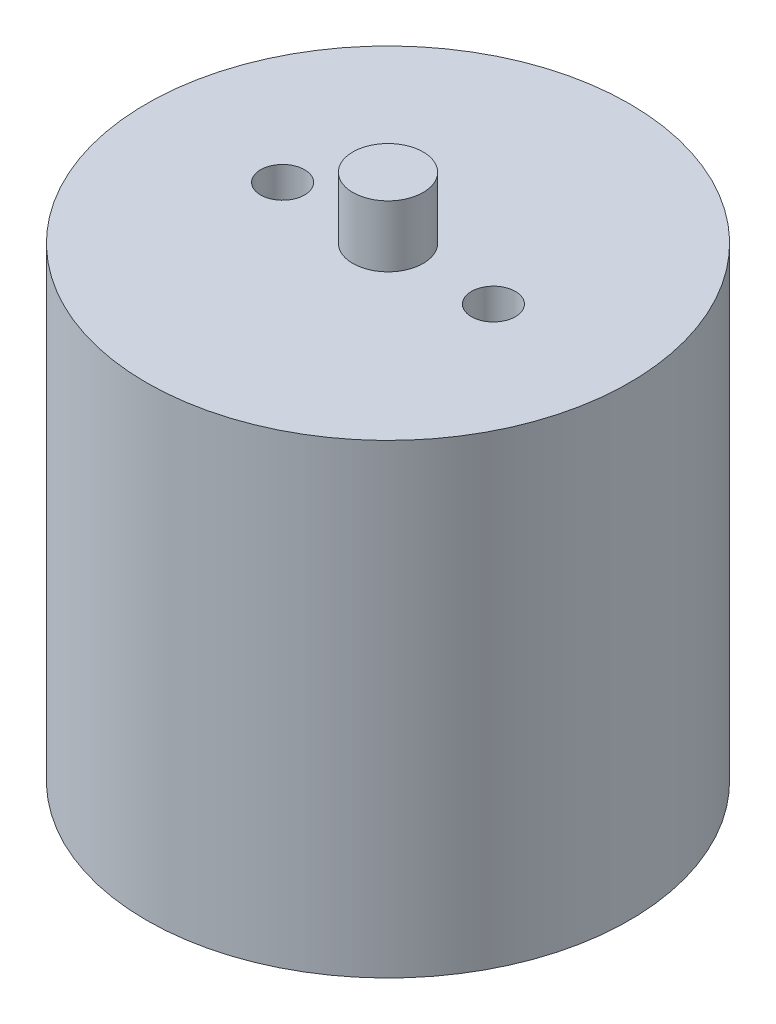
from build123d import *

# Parameters (mm, degrees)
SKETCH2_R           = 13.75
BOSS_EXTRUDE1_DEPTH = 26.5
SKETCH3_R           = 2
BOSS_EXTRUDE2_DEPTH = 3.5
SKETCH4_R           = 1.25
CUT_EXTRUDE1_DEPTH  = 5
BOSS_EXTRUDE3_REACH = 39.959
SKETCH1_R           = 2
SKETCH5_R           = 1.25
CUT_EXTRUDE2_DEPTH  = 5


with BuildPart() as part:
    # Sketch2 → Boss-Extrude1 (new body)
    with BuildSketch(Plane(origin=(0, 2.6, 0), x_dir=(1, 0, 0), z_dir=(0, 1, 0))):
        with Locations(Location((0, 0, 0), (0, 0, 270))):
            Circle(SKETCH2_R)
    extrude(amount=BOSS_EXTRUDE1_DEPTH)

    # Sketch3 → Boss-Extrude2 (add)
    with BuildSketch(Plane(origin=(0, 29.1, 0), x_dir=(1, 0, 0), z_dir=(0, 1, 0))):
        with Locations(Location((0, 0, 0), (0, 0, 270))):
            Circle(SKETCH3_R)
    extrude(amount=BOSS_EXTRUDE2_DEPTH)

    # Sketch4 → Cut-Extrude1 (cut)
    with BuildSketch(Plane(origin=(0, 29.1, 0), x_dir=(1, 0, 0), z_dir=(0, 1, 0))):
        with Locations(Location((-6, 0, 0), (0, 0, 270))):
            Circle(SKETCH4_R)
        with Locations(Location((6, 0, 0), (0, 0, 270))):
            Circle(SKETCH4_R)
    extrude(amount=-CUT_EXTRUDE1_DEPTH, mode=Mode.SUBTRACT)

    # Sketch1 → Boss-Extrude3 (add, up to next)
    with BuildSketch(Plane(origin=(0, 0, 0), x_dir=(1, 0, 0), z_dir=(0, 1, 0)), mode=Mode.PRIVATE) as boss_extrude3_sk1:
        with Locations(Location((0, 0, 0), (0, 0, 270))):
            Circle(SKETCH1_R)
    boss_extrude3_tool1 = extrude(boss_extrude3_sk1.sketch, amount=BOSS_EXTRUDE3_REACH, mode=Mode.PRIVATE) - part.part
    add(boss_extrude3_tool1.solids().sort_by_distance((0, 0, 0))[0])

    # Sketch5 → Cut-Extrude2 (cut)
    with BuildSketch(Plane.XZ.offset(-2.6)):
        with Locations(Location((0, 9.000000034, 0), (0, 0, 270))):
            Circle(SKETCH5_R)
        with Locations(Location((0, -9.000000034, 0), (0, 0, 270))):
            Circle(SKETCH5_R)
        with Locations(Location((-9.5000001, 0, 0), (0, 0, 270))):
            Circle(SKETCH5_R)
        with Locations(Location((9.5, 0, 0), (0, 0, 270))):
            Circle(SKETCH5_R)
    extrude(amount=-CUT_EXTRUDE2_DEPTH, mode=Mode.SUBTRACT)


solid = part.part
